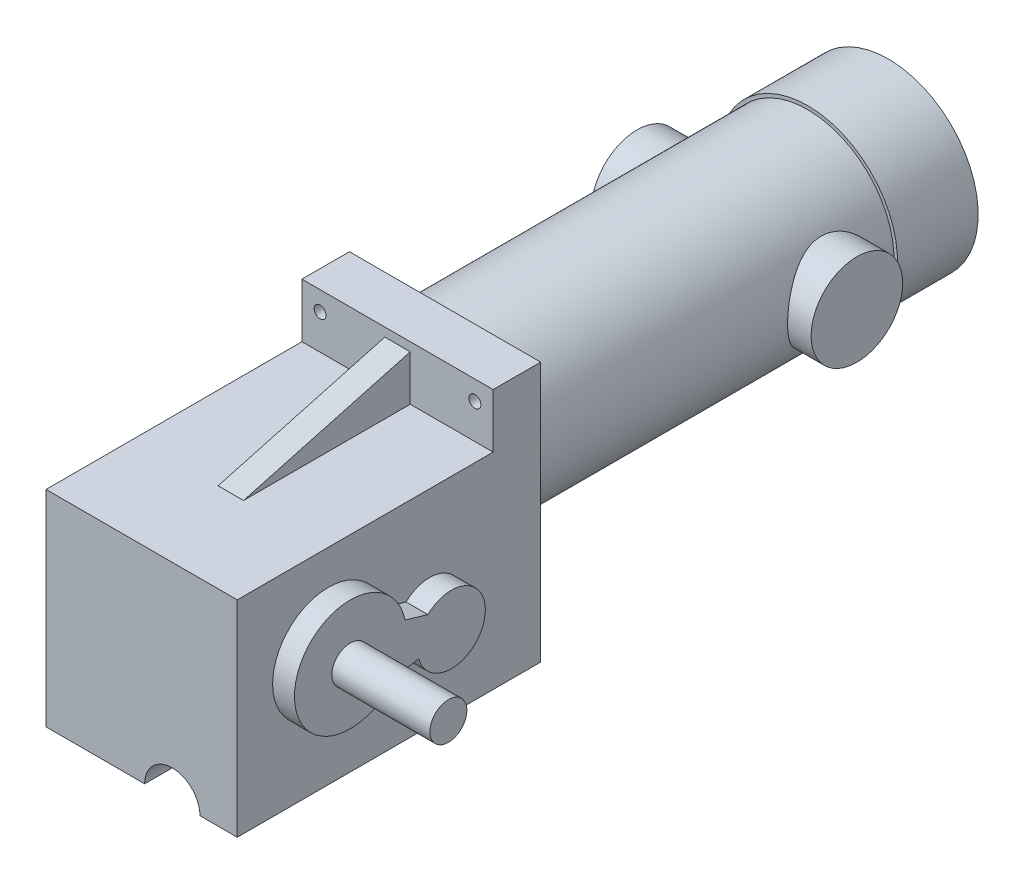
from build123d import *

# Parameters (mm, degrees)
SKETCH1_W                       = 87.884
SKETCH1_H                       = 94.488
BOSS_EXTRUDE1_DEPTH             = 139.446
SKETCH2_R                       = 8.5
BOSS_EXTRUDE2_DEPTH             = 55.118
SKETCH3_R                       = 39.6875
BOSS_EXTRUDE3_DEPTH             = 176.022
SKETCH4_W                       = 87.884
SKETCH4_H                       = 24.892
BOSS_EXTRUDE4_DEPTH             = 21.844
BOSS_EXTRUDE5_DEPTH             = 5.842
NOT_VERIFIED_EXTRUDE_DEPTH      = 10.033
SKETCH8_R                       = 2.75
CUT_EXTRUDE2_DEPTH              = 25.4
SKETCH7_R                       = 12.7
CHANGE_FOR_OPPOSITE_MOTOR_DEPTH = 339.432482365
SKETCH9_R                       = 3
CUT_EXTRUDE3_DEPTH              = 12.7
SKETCH10_R                      = 8.5725
BOSS_EXTRUDE6_DEPTH             = 6.096
SKETCH14_R                      = 1.5
CUT_EXTRUDE4_DEPTH              = 25.4
BOSS_EXTRUDE7_START             = 9.398
SKETCH11_R                      = 8.5
BOSS_EXTRUDE7_DEPTH             = 9.398
SKETCH12_R                      = 21.02690679
BOSS_EXTRUDE8_DEPTH             = 50.4825
SKETCH13_W                      = 14.986
SKETCH13_H                      = 14.986
BOSS_EXTRUDE9_DEPTH             = 6.35
BRAKE_AND_END_CAP_DEPTH         = 27.686
BRAKE_AND_END_CAP_DEPTH_BACK    = 9.398
SKETCH15_R                      = 41.275


with BuildPart() as part:
    # Sketch1 → Boss-Extrude1 (new body)
    with BuildSketch(Plane.XY):
        Rectangle(SKETCH1_W, SKETCH1_H)
    extrude(amount=-BOSS_EXTRUDE1_DEPTH)

    # Sketch2 → Boss-Extrude2 (add)
    with BuildSketch(Plane(origin=(43.942, 0, 0), x_dir=(0, 0, -1), z_dir=(1, 0, 0))):
        with Locations(Location((41.91, 5.6388, 0), (0, 0, 270))):
            Circle(SKETCH2_R)
    extrude(amount=BOSS_EXTRUDE2_DEPTH)

    # Sketch3 → Boss-Extrude3 (add)
    with BuildSketch(Plane(origin=(0, 0, -139.446), x_dir=(-1, 0, 0), z_dir=(0, 0, -1))):
        with Locations(Location((0, 27.686, 0), (0, 0, 150.475215814))):
            Circle(SKETCH3_R)
    extrude(amount=BOSS_EXTRUDE3_DEPTH)

    # Sketch4 → Boss-Extrude4 (add)
    with BuildSketch(Plane.XY.offset(-139.446)):
        with Locations((0, 59.69)):
            Rectangle(SKETCH4_W, SKETCH4_H)
    extrude(amount=BOSS_EXTRUDE4_DEPTH)

    # Sketch5 → Boss-Extrude5 (add, symmetric)
    with BuildSketch(Plane(origin=(0, 0, 0), x_dir=(0, 0, -1), z_dir=(1, 0, 0))):
        Polygon((41.00062989, 47.244), (117.602, 68.118364724), (117.602, 47.244), align=None)
    extrude(amount=BOSS_EXTRUDE5_DEPTH, both=True)

    # Sketch6 → not verified extrude (add)
    with BuildSketch(Plane(origin=(43.942, 0, 0), x_dir=(0, 0, -1), z_dir=(1, 0, 0))):
        with BuildLine():
            Line((67.062792106, 10.685062506), (77.582823134, 7.605402716))
            ThreePointArc((77.582823134, 7.605402716), (103.428106849, -7.84112489), (73.318774576, -7.88601899))
            Line((73.318774576, -7.88601899), (62.51780348, -9.640144719))
            ThreePointArc((62.51780348, -9.640144719), (16.874294712, 11.237119098), (67.062792106, 10.685062506))
        make_face()
    extrude(amount=NOT_VERIFIED_EXTRUDE_DEPTH)

    # Sketch8 → Cut-Extrude2 (cut)
    with BuildSketch(Plane(origin=(0, 0, -139.446), x_dir=(-1, 0, 0), z_dir=(0, 0, -1))):
        with Locations((-35.56, 63.246)):
            Circle(SKETCH8_R)
        with Locations((35.56, 63.246)):
            Circle(SKETCH8_R)
        with Locations((35.56, -7.874)):
            Circle(SKETCH8_R)
        with Locations((-35.56, -7.874)):
            Circle(SKETCH8_R)
    extrude(amount=-CUT_EXTRUDE2_DEPTH, mode=Mode.SUBTRACT)

    # Sketch7 → change for opposite motor (cut, through all)
    with BuildSketch(Plane.XY):
        with Locations((14.097, -47.244)):
            Circle(SKETCH7_R)
    extrude(amount=-CHANGE_FOR_OPPOSITE_MOTOR_DEPTH, mode=Mode.SUBTRACT)

    # Sketch9 → Cut-Extrude3 (cut)
    with BuildSketch(Plane.XZ.offset(47.244)):
        with Locations((-8.001, -7.9756)):
            Circle(SKETCH9_R)
        with Locations((-8.001, -68.3768)):
            Circle(SKETCH9_R)
        with Locations((-8.001, -128.778)):
            Circle(SKETCH9_R)
        with Locations((36.449, -128.778)):
            Circle(SKETCH9_R)
        with Locations((36.449, -68.3768)):
            Circle(SKETCH9_R)
        with Locations((36.449, -7.9756)):
            Circle(SKETCH9_R)
    extrude(amount=-CUT_EXTRUDE3_DEPTH, mode=Mode.SUBTRACT)

    # Sketch10 → Boss-Extrude6 (add)
    with BuildSketch(Plane.XZ.offset(47.244)):
        with Locations(Location((-32.639, -31.496, 0), (0, 0, 180))):
            Circle(SKETCH10_R)
        with Locations(Location((-32.639, -104.4448, 0), (0, 0, 180))):
            Circle(SKETCH10_R)
    extrude(amount=BOSS_EXTRUDE6_DEPTH)

    # Sketch14 → Cut-Extrude4 (cut)
    with BuildSketch(Plane(origin=(0, 0, -315.468), x_dir=(-1, 0, 0), z_dir=(0, 0, -1))):
        with Locations((-26.5, 27.686)):
            Circle(SKETCH14_R)
        with Locations((26.5, 27.686)):
            Circle(SKETCH14_R)
    extrude(amount=-CUT_EXTRUDE4_DEPTH, mode=Mode.SUBTRACT)

    # Sketch11 → Boss-Extrude7 (add)
    with BuildSketch(Plane.ZY.offset(43.942).offset(BOSS_EXTRUDE7_START)):
        with BuildLine():
            Line((-77.582823134, 7.605402716), (-67.062792106, 10.685062506))
            ThreePointArc((-67.062792106, 10.685062506), (-16.874294712, 11.237119098), (-62.51780348, -9.640144719))
            Line((-62.51780348, -9.640144719), (-73.318774576, -7.88601899))
            ThreePointArc((-73.318774576, -7.88601899), (-103.428106849, -7.84112489), (-77.582823134, 7.605402716))
        make_face()
        with Locations(Location((-41.91, 5.6388, 0), (0, 0, 270))):
            Circle(SKETCH11_R, mode=Mode.SUBTRACT)
    extrude(amount=-BOSS_EXTRUDE7_DEPTH)

    # Sketch12 → Boss-Extrude8 (add, symmetric)
    with BuildSketch(Plane(origin=(0, 0, 0), x_dir=(0, 0, -1), z_dir=(1, 0, 0))):
        with Locations(Location((278.212507153, 26.972524542, 0), (0, 0, 180))):
            Circle(SKETCH12_R)
    extrude(amount=BOSS_EXTRUDE8_DEPTH, both=True)

    # Sketch13 → Boss-Extrude9 (add)
    with BuildSketch(Plane(origin=(0, 0, -315.468), x_dir=(-1, 0, 0), z_dir=(0, 0, -1))):
        with Locations((0, 27.686)):
            Rectangle(SKETCH13_W, SKETCH13_H)
    extrude(amount=BOSS_EXTRUDE9_DEPTH)

    # Sketch15 → brake and end cap (add, two sides: drawn at the far end of the back side and taken through both)
    with BuildSketch(Plane(origin=(0, 0, -315.468), x_dir=(-1, 0, 0), z_dir=(0, 0, -1)).offset(-BRAKE_AND_END_CAP_DEPTH_BACK)):
        with Locations((0, 27.686)):
            Circle(SKETCH15_R)
    extrude(amount=BRAKE_AND_END_CAP_DEPTH + BRAKE_AND_END_CAP_DEPTH_BACK)


solid = part.part
